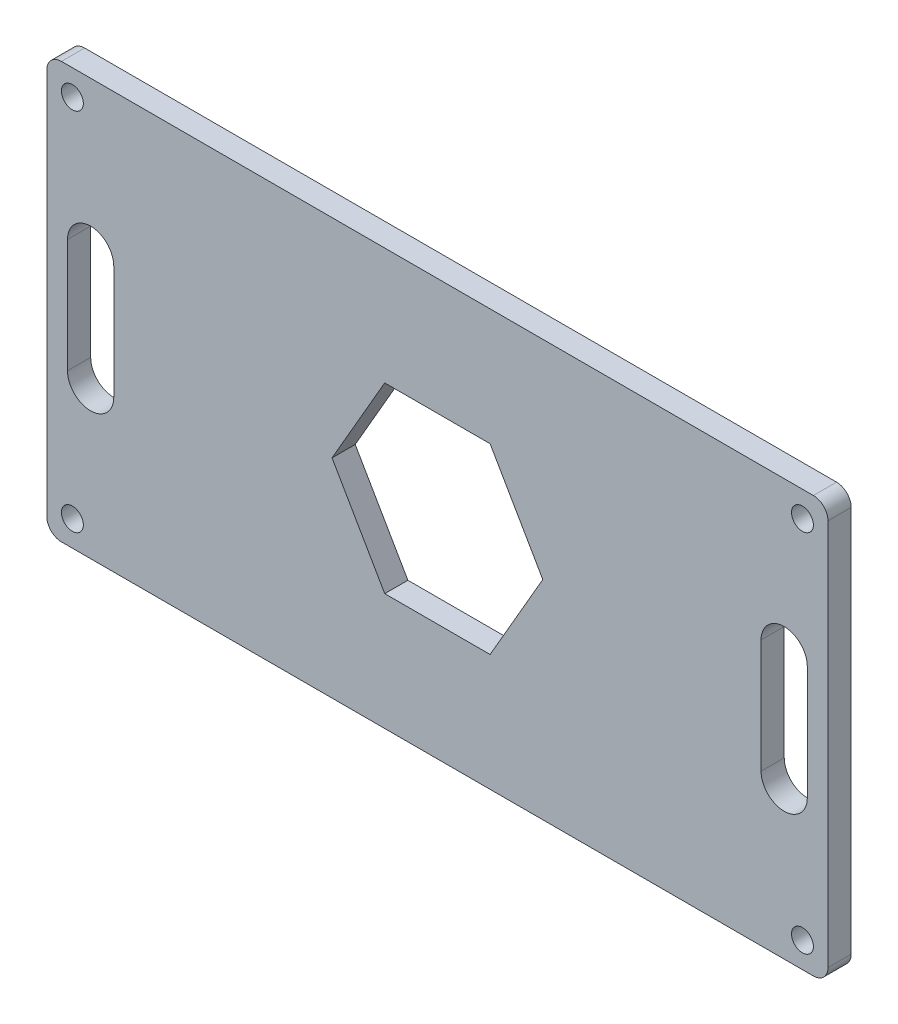
from build123d import *

# Parameters (mm, degrees)
SKETCH1_W           = 107
SKETCH1_H           = 57
SKETCH1_R           = 1.5
BOSS_EXTRUDE1_DEPTH = 3.175
FILLET1_R           = 2
CUT_EXTRUDE1_DEPTH  = 3.175


with BuildPart() as part:
    # Sketch1 → Boss-Extrude1 (new body)
    with BuildSketch(Plane.XY):
        Rectangle(SKETCH1_W, SKETCH1_H)
        with Locations((-50, 25)):
            Circle(SKETCH1_R, mode=Mode.SUBTRACT)
        with Locations((50, 25)):
            Circle(SKETCH1_R, mode=Mode.SUBTRACT)
        with Locations((-50, -25)):
            Circle(SKETCH1_R, mode=Mode.SUBTRACT)
        with Locations((50, -25)):
            Circle(SKETCH1_R, mode=Mode.SUBTRACT)
    extrude(amount=BOSS_EXTRUDE1_DEPTH)

    # Fillet1
    fillet1_edges = [part.edges().sort_by_distance(p)[0] for p in [
        (-53.5, 28.5, 1.5875),
        (53.5, 28.5, 1.5875),
        (53.5, -28.5, 1.5875),
        (-53.5, -28.5, 1.5875),
    ]]
    fillet(fillet1_edges, radius=FILLET1_R)

    # Sketch2 → Cut-Extrude1 (cut)
    with BuildSketch(Plane.XY.offset(3.175)):
        with BuildLine():
            Line((44.332340651, -7.787162566), (44.332340651, 7.787162566))
            ThreePointArc((44.332340651, 7.787162566), (47.5, 10.954821915), (50.667659349, 7.787162566))
            Line((50.667659349, 7.787162566), (50.667659349, -7.787162566))
            ThreePointArc((50.667659349, -7.787162566), (47.5, -10.954821915), (44.332340651, -7.787162566))
        make_face()
        with BuildLine():
            Line((-50.667659349, -7.787162566), (-50.667659349, 7.787162566))
            ThreePointArc((-50.667659349, 7.787162566), (-47.5, 10.954821915), (-44.332340651, 7.787162566))
            Line((-44.332340651, 7.787162566), (-44.332340651, -7.787162566))
            ThreePointArc((-44.332340651, -7.787162566), (-47.5, -10.954821915), (-50.667659349, -7.787162566))
        make_face()
        Polygon((14.43375673, 0), (7.216878365, 12.5), (-7.216878365, 12.5), (-14.43375673, 0), (-7.216878365, -12.5), (7.216878365, -12.5), align=None)
    extrude(amount=-CUT_EXTRUDE1_DEPTH, mode=Mode.SUBTRACT)


solid = part.part
